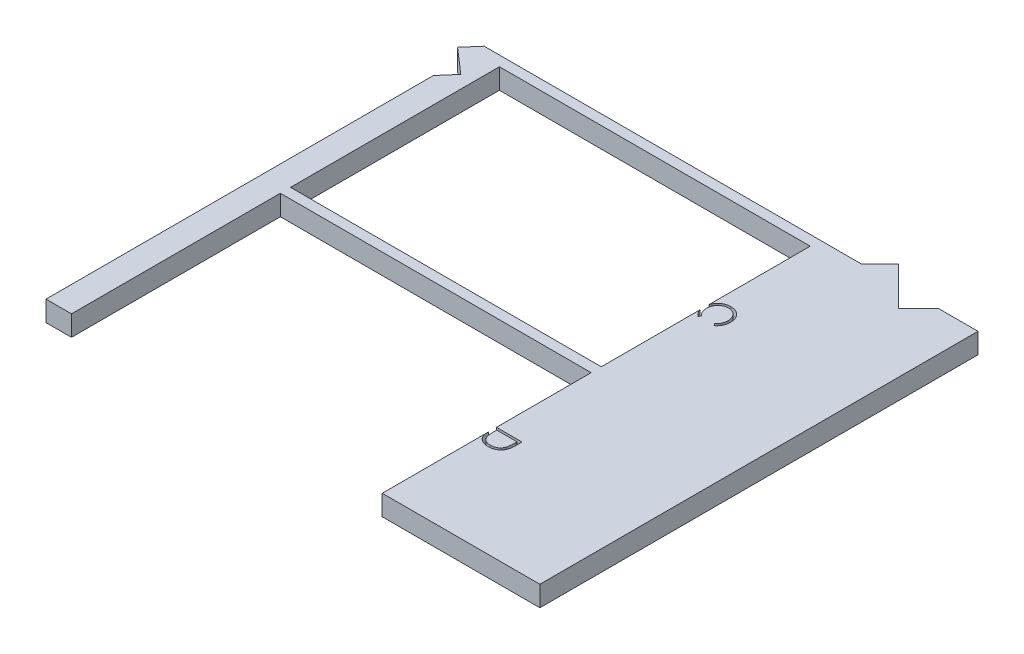
from build123d import *

# Parameters (mm, degrees)
SKETCH1_W           = 77.47
SKETCH1_H           = 52.07
BOSS_EXTRUDE4_DEPTH = 5.08
CUT_EXTRUDE9_DEPTH  = 5.08
CUT_EXTRUDE10_DEPTH = 5.08


with BuildPart() as part:
    # Sketch1 → Boss-Extrude4 (new body)
    with BuildSketch(Plane(origin=(0, 0, 0), x_dir=(1, 0, 0), z_dir=(0, 1, 0))):
        Polygon((-151.207591036, -110.49), (-146.05, -110.49), (-146.05, -58.42), (-68.58, -58.42), (-68.58, -110.49), (-55.88, -110.49), (-55.88, -58.42), (21.59, -58.42), (21.59, -110.49), (34.29, -110.49), (34.29, -58.42), (111.76, -58.42), (111.76, -110.49), (151.052408964, -110.49), (151.052408964, 110.49), (-151.207591036, 110.49), align=None)
        with Locations((-107.315, -29.845)):
            Rectangle(SKETCH1_W, SKETCH1_H, mode=Mode.SUBTRACT)
        with Locations((-17.145, -29.845)):
            Rectangle(SKETCH1_W, SKETCH1_H, mode=Mode.SUBTRACT)
        with Locations((73.025, -29.845)):
            Rectangle(SKETCH1_W, SKETCH1_H, mode=Mode.SUBTRACT)
        with Locations((-107.315, 24.765)):
            Rectangle(SKETCH1_W, SKETCH1_H, mode=Mode.SUBTRACT)
        with Locations((-17.145, 24.765)):
            Rectangle(SKETCH1_W, SKETCH1_H, mode=Mode.SUBTRACT)
        with Locations((-107.315, 79.375)):
            Rectangle(SKETCH1_W, SKETCH1_H, mode=Mode.SUBTRACT)
        with Locations((-17.145, 79.375)):
            Rectangle(SKETCH1_W, SKETCH1_H, mode=Mode.SUBTRACT)
        with Locations((73.025, 24.765)):
            Rectangle(SKETCH1_W, SKETCH1_H, mode=Mode.SUBTRACT)
        with Locations((73.025, 79.375)):
            Rectangle(SKETCH1_W, SKETCH1_H, mode=Mode.SUBTRACT)
    extrude(amount=BOSS_EXTRUDE4_DEPTH)

    # Sketch8 → Cut-Extrude9 (cut)
    # profile 1 of 7: a face of its own
    with BuildSketch(Plane(origin=(0, 5.08, 0), x_dir=(1, 0, 0), z_dir=(0, 1, 0))):
        Polygon((118.11, 79.293589744), (111.76, 76.362820513), (111.76, 76.982301683), (113.79525641, 77.921063702), (113.79525641, 80.799679487), (111.76, 81.765154247), (111.76, 82.387179487), (118.11, 79.375), align=None)
        Polygon((116.872309696, 79.340655048), (114.446538462, 80.49057492), (114.446538462, 78.221264022), align=None, mode=Mode.SUBTRACT)
    # profile 2 of 7: a face of its own
    with BuildSketch(Plane(origin=(0, 5.08, 0), x_dir=(1, 0, 0), z_dir=(0, 1, 0))):
        with BuildLine():
            Line((118.11, 26.474615385), (118.11, 25.235653045))
            add(Edge.make_bspline(
                [(118.11, 25.235653045), (118.109681139, 25.175004234), (118.109063106, 25.057451746), (118.099477996, 24.886510758), (118.086408481, 24.726402202), (118.065671027, 24.577079644), (118.040648803, 24.438612083), (118.010346937, 24.310582227), (117.974012938, 24.193397201), (117.916234684, 24.053492664), (117.830376936, 23.893979465), (117.703506539, 23.721262382), (117.548326213, 23.573571833), (117.37327911, 23.4462338), (117.180718496, 23.344994626), (116.975233967, 23.271753187), (116.75947595, 23.225383899), (116.611351899, 23.220615168), (116.536492388, 23.218205128)],
                knots=[0, 0, 0, 0, 1.001505555, 1.941167018, 2.826882275, 3.653841531, 4.429895133, 5.150066043, 5.825578002, 6.45369114, 7.647487171, 8.808567382, 9.977351308, 11.170798116, 12.373658725, 13.556498008, 14.765093433, 16, 16, 16, 16], degree=3))
            add(Edge.make_bspline(
                [(116.536492388, 23.218205128), (116.466353726, 23.220150205), (116.328524642, 23.223972465), (116.12725909, 23.261767034), (115.934882118, 23.318037757), (115.753765338, 23.399726219), (115.586236491, 23.504802861), (115.433291194, 23.631250472), (115.29863595, 23.781802882), (115.223670167, 23.894781468), (115.185590946, 23.952169471)],
                knots=[0, 0, 0, 0, 1.044266239, 2.052081639, 3.041743201, 4.026043445, 5.00270663, 5.980942822, 6.97441044, 8, 8, 8, 8], degree=3))
            add(Edge.make_bspline(
                [(115.185590946, 23.952169471), (115.157917248, 23.880020614), (115.10497061, 23.741981978), (115.010852235, 23.551885993), (114.90963819, 23.387448746), (114.798522364, 23.248489243), (114.677253559, 23.131437365), (114.548260115, 23.026322349), (114.405191505, 22.938259533), (114.252121508, 22.862606152), (114.090124446, 22.803067733), (113.919941192, 22.760940396), (113.743474705, 22.735055197), (113.623194862, 22.731525492), (113.562473958, 22.72974359)],
                knots=[0, 0, 0, 0, 1.272302504, 2.434229863, 3.488457646, 4.447234501, 5.35599188, 6.26022912, 7.18267843, 8.11661068, 9.06895546, 10.019249207, 11.000057067, 12, 12, 12, 12], degree=3))
            add(Edge.make_bspline(
                [(113.562473958, 22.72974359), (113.500485842, 22.731516424), (113.378522486, 22.735004524), (113.199347436, 22.7607231), (113.028142769, 22.804311677), (112.863691196, 22.864204763), (112.70692357, 22.942816916), (112.555876508, 23.036423505), (112.414573802, 23.150354586), (112.279655118, 23.277346904), (112.158418428, 23.421179366), (112.05048411, 23.576340817), (111.961311987, 23.745062992), (111.887341532, 23.924729456), (111.830014808, 24.116534097), (111.790215937, 24.31976575), (111.763336967, 24.53446858), (111.761131196, 24.681807332), (111.76, 24.757367788)],
                knots=[0, 0, 0, 0, 0.978404568, 1.925038397, 2.85041836, 3.763147166, 4.682162379, 5.614488577, 6.562659439, 7.54271123, 8.535210642, 9.526693784, 10.520907202, 11.541451354, 12.589717429, 13.675358278, 14.807842563, 16, 16, 16, 16], degree=3))
            Line((111.76, 24.757367788), (111.76, 26.474615385))
            Line((111.76, 26.474615385), (118.11, 26.474615385))
        make_face()
        with BuildLine():
            Line((117.458717949, 25.90474359), (115.423461538, 25.90474359))
            Line((115.423461538, 25.90474359), (115.423461538, 25.521860978))
            add(Edge.make_bspline(
                [(115.423461538, 25.521860978), (115.424181075, 25.465891945), (115.425571367, 25.357748368), (115.429679415, 25.200723225), (115.440678409, 25.055331233), (115.452311659, 24.921071395), (115.470224485, 24.798843581), (115.49214475, 24.688238604), (115.515124768, 24.588262886), (115.554315522, 24.473021329), (115.611648095, 24.342338932), (115.702715767, 24.203911992), (115.808237502, 24.079896012), (115.932241327, 23.976344233), (116.067626032, 23.890895914), (116.214403686, 23.833871415), (116.366844139, 23.793424687), (116.471770578, 23.789877771), (116.525044071, 23.788076923)],
                knots=[0, 0, 0, 0, 1.156481963, 2.23455883, 3.244418989, 4.168404366, 5.01828131, 5.794834307, 6.498111525, 7.13526334, 8.307595709, 9.435046769, 10.546766856, 11.659452936, 12.760769924, 13.837671619, 14.902137667, 16, 16, 16, 16], degree=3))
            add(Edge.make_bspline(
                [(116.525044071, 23.788076923), (116.56030457, 23.788977603), (116.629471889, 23.790744385), (116.729913527, 23.8068242), (116.82558773, 23.830156168), (116.914294057, 23.866607821), (116.998553798, 23.910685404), (117.074624411, 23.96802234), (117.1466735, 24.032775181), (117.212055599, 24.108821091), (117.270638216, 24.195791849), (117.322185781, 24.294516129), (117.362847974, 24.406172748), (117.399324126, 24.528230019), (117.4246346, 24.66264136), (117.445797527, 24.808093389), (117.456555228, 24.965820019), (117.457980962, 25.074940101), (117.458717949, 25.131346154)],
                knots=[0, 0, 0, 0, 0.911752476, 1.788502045, 2.626783689, 3.45400582, 4.26402138, 5.080402872, 5.911472738, 6.767166405, 7.66795952, 8.620018292, 9.640966946, 10.73819047, 11.913090943, 13.176185384, 14.540321519, 16, 16, 16, 16], degree=3))
            Line((117.458717949, 25.131346154), (117.458717949, 25.90474359))
        make_face(mode=Mode.SUBTRACT)
        with BuildLine():
            Line((114.772179487, 25.90474359), (112.411282051, 25.90474359))
            Line((112.411282051, 25.90474359), (112.411282051, 25.093185096))
            add(Edge.make_bspline(
                [(112.411282051, 25.093185096), (112.411975847, 25.035093328), (112.413313047, 24.923129104), (112.417726104, 24.761477849), (112.427553327, 24.612056238), (112.443574322, 24.47477829), (112.460221531, 24.348435585), (112.483262073, 24.23428334), (112.509456384, 24.132146551), (112.549993321, 24.013731405), (112.612860676, 23.880302727), (112.708268617, 23.736613475), (112.820435778, 23.607586425), (112.95189156, 23.499274679), (113.093745082, 23.409835086), (113.245254404, 23.347105881), (113.401797428, 23.306771901), (113.508807295, 23.302005692), (113.562473958, 23.299615385)],
                knots=[0, 0, 0, 0, 1.159821618, 2.235403267, 3.228114831, 4.14795534, 4.994323282, 5.771256229, 6.471395042, 7.097801288, 8.267864287, 9.404187171, 10.531774336, 11.667624178, 12.792825787, 13.866573821, 14.930062559, 16, 16, 16, 16], degree=3))
            add(Edge.make_bspline(
                [(113.562473958, 23.299615385), (113.596030503, 23.300103956), (113.662602321, 23.301073218), (113.760357737, 23.31624054), (113.855472736, 23.337399943), (113.946509043, 23.368040578), (114.034948011, 23.406675936), (114.119249173, 23.455161844), (114.2014282, 23.511153881), (114.305201688, 23.598743929), (114.42480707, 23.726024945), (114.541892162, 23.906931894), (114.636322991, 24.112618706), (114.676417579, 24.261803289), (114.697129407, 24.338868189)],
                knots=[0, 0, 0, 0, 0.723503378, 1.435336582, 2.130201219, 2.824764462, 3.504949994, 4.209866579, 4.920640069, 5.648298893, 7.13757748, 8.670694625, 10.280166878, 12, 12, 12, 12], degree=3))
            add(Edge.make_bspline(
                [(114.697129407, 24.338868189), (114.703398338, 24.369763806), (114.716990673, 24.436751875), (114.731329404, 24.545986183), (114.744191712, 24.671110852), (114.753456167, 24.811591078), (114.763401398, 24.967985569), (114.767131466, 25.140244081), (114.771684212, 25.328488394), (114.772010172, 25.459103286), (114.772179487, 25.526949119)],
                knots=[0, 0, 0, 0, 0.634452549, 1.375623993, 2.216454381, 3.166361212, 4.209414599, 5.370755378, 6.634280627, 8, 8, 8, 8], degree=3))
            Line((114.772179487, 25.526949119), (114.772179487, 25.90474359))
        make_face(mode=Mode.SUBTRACT)
    # profile 3 of 7: a face of its own
    with BuildSketch(Plane(origin=(0, 5.08, 0), x_dir=(1, 0, 0), z_dir=(0, 1, 0))):
        with BuildLine():
            Line((116.944815705, -32.938589744), (116.563205128, -32.439951923))
            add(Edge.make_bspline(
                [(116.563205128, -32.439951923), (116.605597673, -32.40438124), (116.689811221, -32.333719444), (116.808065537, -32.220037748), (116.918855368, -32.10156191), (117.022708493, -31.978337218), (117.115993196, -31.848145673), (117.203570769, -31.714141081), (117.282070808, -31.574081771), (117.377253654, -31.380403623), (117.476578821, -31.127042527), (117.559860398, -30.808100462), (117.612875959, -30.475158898), (117.618617886, -30.248014681), (117.621538462, -30.132479968)],
                knots=[0, 0, 0, 0, 0.757959112, 1.505699292, 2.245454638, 2.979532153, 3.711538275, 4.438200793, 5.171680507, 5.909471876, 7.393775596, 8.890124382, 10.418191784, 12, 12, 12, 12], degree=3))
            add(Edge.make_bspline(
                [(117.621538462, -30.132479968), (117.620802251, -30.068829613), (117.619336663, -29.942119638), (117.600137483, -29.754060275), (117.572842033, -29.56915638), (117.533326202, -29.388095544), (117.481880175, -29.211237272), (117.421547717, -29.037234935), (117.346470096, -28.868137816), (117.263556886, -28.701910874), (117.169880198, -28.542661658), (117.067735433, -28.391952614), (116.958125128, -28.250472259), (116.84133222, -28.117828549), (116.715905207, -27.995476207), (116.58331959, -27.881454356), (116.441979536, -27.777817938), (116.294535759, -27.682020268), (116.140771545, -27.596777475), (115.9816542, -27.523166197), (115.817792087, -27.46007521), (115.648849522, -27.409690045), (115.475491338, -27.369948117), (115.297349628, -27.342492588), (115.114770175, -27.323466123), (114.991019157, -27.322014016), (114.928639824, -27.321282051)],
                knots=[0, 0, 0, 0, 1.055000685, 2.100209969, 3.131349012, 4.153242145, 5.170189196, 6.184191144, 7.204341339, 8.235672124, 9.263040994, 10.265373269, 11.252624173, 12.22887325, 13.193405896, 14.155809299, 15.126090485, 16.097288279, 17.069732292, 18.038585918, 19.002221264, 19.978698174, 20.959418239, 21.948869816, 22.966084182, 24, 24, 24, 24], degree=3))
            add(Edge.make_bspline(
                [(114.928639824, -27.321282051), (114.834784429, -27.323571352), (114.650511811, -27.328066089), (114.380599417, -27.368068066), (114.122026195, -27.428855875), (113.876408481, -27.519961279), (113.640717603, -27.632300128), (113.418941397, -27.774250951), (113.207728487, -27.938655241), (113.012070568, -28.12783883), (112.833338524, -28.335403668), (112.675948183, -28.55810345), (112.544748325, -28.795383515), (112.435571964, -29.044623973), (112.351649044, -29.307742779), (112.29256842, -29.584266778), (112.254029036, -29.873594541), (112.250339344, -30.071296166), (112.248461538, -30.171913061)],
                knots=[0, 0, 0, 0, 1.029171465, 2.020641659, 2.987623507, 3.938342917, 4.889210282, 5.84687017, 6.821220943, 7.821438502, 8.827599549, 9.822697543, 10.807740252, 11.797342354, 12.80366471, 13.83203677, 14.896651826, 16, 16, 16, 16], degree=3))
            add(Edge.make_bspline(
                [(112.248461538, -30.171913061), (112.251525467, -30.282770797), (112.257556013, -30.50096534), (112.308644936, -30.820947331), (112.391481444, -31.127263648), (112.507410532, -31.41993077), (112.658114697, -31.698123628), (112.840809417, -31.962277569), (113.057232535, -32.212615561), (113.222483354, -32.363149173), (113.306794872, -32.439951923)],
                knots=[0, 0, 0, 0, 1.028121516, 2.023589091, 2.998037872, 3.967518031, 4.937445131, 5.927275754, 6.942489185, 8, 8, 8, 8], degree=3))
            Line((113.306794872, -32.439951923), (112.929000401, -32.938589744))
            add(Edge.make_bspline(
                [(112.929000401, -32.938589744), (112.877223407, -32.898461226), (112.773917427, -32.818396404), (112.628282924, -32.688750355), (112.491292127, -32.552178781), (112.36407883, -32.407649584), (112.243987323, -32.256891333), (112.135043577, -32.097248498), (112.033928993, -31.93147842), (111.942568033, -31.758615962), (111.860652906, -31.579228654), (111.791497891, -31.393503181), (111.731069307, -31.20301302), (111.681684053, -31.007662239), (111.643076564, -30.806798224), (111.617282312, -30.601110145), (111.599606535, -30.390163816), (111.597995761, -30.247848605), (111.597179487, -30.175729167)],
                knots=[0, 0, 0, 0, 0.986756325, 1.968786143, 2.935506311, 3.899499537, 4.868307269, 5.8376204, 6.809456583, 7.792545619, 8.781780509, 9.778496008, 10.776623214, 11.79151764, 12.812666265, 13.856269958, 14.913646641, 16, 16, 16, 16], degree=3))
            add(Edge.make_bspline(
                [(111.597179487, -30.175729167), (111.597654817, -30.107432799), (111.598594721, -29.97238519), (111.613820511, -29.772997455), (111.634593605, -29.578887787), (111.665872129, -29.390610966), (111.702782574, -29.207139554), (111.752260425, -29.030136779), (111.807685342, -28.857860898), (111.872827246, -28.691004051), (111.946335178, -28.52942431), (112.029414149, -28.373642823), (112.121365532, -28.223731239), (112.220162479, -28.07821569), (112.328978441, -27.939245788), (112.446302192, -27.805617249), (112.571738298, -27.676580756), (112.662189246, -27.596747314), (112.707666266, -27.556608574)],
                knots=[0, 0, 0, 0, 1.114604814, 2.203992996, 3.262667896, 4.300477797, 5.318619304, 6.316056647, 7.298880507, 8.271930387, 9.238335007, 10.195173496, 11.151986948, 12.108099108, 13.064862484, 14.031167946, 15.010108607, 16, 16, 16, 16], degree=3))
            add(Edge.make_bspline(
                [(112.707666266, -27.556608574), (112.786662423, -27.492318192), (112.943701026, -27.364513598), (113.198219878, -27.200999858), (113.463955057, -27.061032151), (113.742302642, -26.947864409), (114.032638045, -26.859394879), (114.335107621, -26.798106139), (114.649428887, -26.758279657), (114.86321849, -26.753725276), (114.971889022, -26.751410256)],
                knots=[0, 0, 0, 0, 0.994628077, 1.977248131, 2.950237994, 3.925870899, 4.908910175, 5.911660606, 6.938484602, 8, 8, 8, 8], degree=3))
            add(Edge.make_bspline(
                [(114.971889022, -26.751410256), (115.086103424, -26.754244442), (115.310813128, -26.759820525), (115.640671219, -26.806804203), (115.956243845, -26.883302707), (116.258745252, -26.988641657), (116.546444643, -27.127611896), (116.820557094, -27.295846609), (117.080858784, -27.494989044), (117.324021732, -27.72253816), (117.546337205, -27.97213776), (117.741930009, -28.239412742), (117.904702809, -28.523860895), (118.040767384, -28.82234304), (118.145350881, -29.137095699), (118.218563099, -29.467446937), (118.264132722, -29.812776116), (118.269893457, -30.048383659), (118.272820513, -30.168096955)],
                knots=[0, 0, 0, 0, 1.032901378, 2.032168977, 3.007206631, 3.966850309, 4.924221947, 5.891988639, 6.871730993, 7.884084801, 8.900290346, 9.89161143, 10.874607481, 11.860025555, 12.854717796, 13.869097222, 14.917278314, 16, 16, 16, 16], degree=3))
            add(Edge.make_bspline(
                [(118.272820513, -30.168096955), (118.27194643, -30.24105764), (118.270216271, -30.385475968), (118.253322795, -30.599110851), (118.225211517, -30.807112405), (118.186697164, -31.009983654), (118.139491479, -31.208460249), (118.077695589, -31.40050597), (118.005935411, -31.587166578), (117.925394904, -31.768581871), (117.833318651, -31.942778105), (117.733314188, -32.109723579), (117.623073079, -32.267404402), (117.506239897, -32.418786561), (117.378444314, -32.560461963), (117.243848093, -32.696476823), (117.098457292, -32.822132675), (116.996123317, -32.89969966), (116.944815705, -32.938589744)],
                knots=[0, 0, 0, 0, 1.096705196, 2.170817488, 3.219277236, 4.250701065, 5.274195539, 6.284202015, 7.28098643, 8.279664616, 9.266225751, 10.241373748, 11.203306326, 12.157093976, 13.114198862, 14.069774147, 15.032234603, 16, 16, 16, 16], degree=3))
        make_face()
    # profile 4 of 7: a face of its own
    with BuildSketch(Plane(origin=(0, 5.08, 0), x_dir=(1, 0, 0), z_dir=(0, 1, 0))):
        with BuildLine():
            Line((111.76, -82.012692308), (118.11, -82.012692308))
            Line((118.11, -82.012692308), (118.11, -83.294903846))
            add(Edge.make_bspline(
                [(118.11, -83.294903846), (118.10919924, -83.406426385), (118.107652175, -83.62188735), (118.097786915, -83.933238257), (118.080511466, -84.220906485), (118.054862343, -84.484728674), (118.024076207, -84.725128674), (117.984923928, -84.941721457), (117.938878197, -85.134858028), (117.899605318, -85.253638066), (117.881033654, -85.309807692)],
                knots=[0, 0, 0, 0, 1.314317071, 2.539253741, 3.67075822, 4.709970291, 5.662644612, 6.526156501, 7.303037452, 8, 8, 8, 8], degree=3))
            add(Edge.make_bspline(
                [(117.881033654, -85.309807692), (117.853037914, -85.383276673), (117.797681284, -85.528548601), (117.693258165, -85.735390771), (117.574941266, -85.930107124), (117.44258475, -86.11375686), (117.2924032, -86.282089414), (117.130916153, -86.441891296), (116.951524797, -86.585988874), (116.760320009, -86.720164865), (116.555362101, -86.837571052), (116.340810785, -86.941109671), (116.117067511, -87.029513574), (115.882503759, -87.098492965), (115.639371325, -87.15548169), (115.385829701, -87.193719768), (115.123356971, -87.219119775), (114.945238152, -87.221659883), (114.854861779, -87.222948718)],
                knots=[0, 0, 0, 0, 0.98467389, 1.947018643, 2.898343565, 3.837828625, 4.779009928, 5.722093987, 6.681368302, 7.658573986, 8.646467994, 9.637429229, 10.641859304, 11.657149908, 12.698561448, 13.768651538, 14.867827761, 16, 16, 16, 16], degree=3))
            add(Edge.make_bspline(
                [(114.854861779, -87.222948718), (114.776373797, -87.221806822), (114.621705032, -87.219556598), (114.39375275, -87.199375846), (114.172580583, -87.169987158), (113.959159893, -87.124695693), (113.752052982, -87.069043404), (113.552243376, -87.000351318), (113.359584615, -86.918944546), (113.175646042, -86.82449634), (113.000731948, -86.721221421), (112.837852299, -86.607986514), (112.683909336, -86.491289421), (112.545846691, -86.362132049), (112.415768103, -86.229414775), (112.300701958, -86.08609986), (112.195636064, -85.936856417), (112.101337325, -85.778809783), (112.019522725, -85.608171823), (111.94943361, -85.422613554), (111.891722261, -85.221141181), (111.843495333, -85.004063511), (111.805260876, -84.770955192), (111.779629867, -84.521602395), (111.762298604, -84.256383924), (111.760781079, -84.074267288), (111.76, -83.980530849)],
                knots=[0, 0, 0, 0, 1.105818345, 2.179130549, 3.222742436, 4.24813173, 5.251184997, 6.243232575, 7.223185975, 8.195898781, 9.155064964, 10.083206407, 10.990357329, 11.874224667, 12.744762365, 13.607037788, 14.46074101, 15.315384698, 16.197310979, 17.123950979, 18.107232398, 19.148086642, 20.256146639, 21.433991621, 22.679261309, 24, 24, 24, 24], degree=3))
            Line((111.76, -83.980530849), (111.76, -82.012692308))
        make_face()
        with BuildLine():
            Line((112.411282051, -82.582564103), (112.411282051, -83.311440304))
            add(Edge.make_bspline(
                [(112.411282051, -83.311440304), (112.411732169, -83.416176063), (112.41259791, -83.617621283), (112.420194693, -83.907286506), (112.432607922, -84.171953411), (112.449979849, -84.411659579), (112.472964337, -84.626269665), (112.498590946, -84.816232183), (112.53051775, -84.980924438), (112.559457347, -85.08058213), (112.572830529, -85.126634615)],
                knots=[0, 0, 0, 0, 1.375205317, 2.645023457, 3.804390687, 4.853969522, 5.800190428, 6.637939096, 7.370582563, 8, 8, 8, 8], degree=3))
            add(Edge.make_bspline(
                [(112.572830529, -85.126634615), (112.593242549, -85.184599298), (112.633579048, -85.299144178), (112.707184232, -85.464010709), (112.794265109, -85.61784952), (112.891632722, -85.763227177), (113.000795015, -85.899202305), (113.122082386, -86.02517169), (113.254153497, -86.142030641), (113.397503093, -86.248500834), (113.551204387, -86.34363756), (113.713300631, -86.426559757), (113.883400607, -86.496918019), (114.062117399, -86.554129451), (114.249282549, -86.598465023), (114.444403664, -86.63000926), (114.647541614, -86.649619319), (114.785702691, -86.651909464), (114.856133814, -86.653076923)],
                knots=[0, 0, 0, 0, 0.998463025, 1.973077781, 2.929496817, 3.867873318, 4.813809365, 5.759268434, 6.706333209, 7.676553387, 8.657505312, 9.640584699, 10.632319813, 11.645628493, 12.686877747, 13.755137172, 14.855624085, 16, 16, 16, 16], degree=3))
            add(Edge.make_bspline(
                [(114.856133814, -86.653076923), (114.930398398, -86.652144681), (115.07629183, -86.650313282), (115.290366967, -86.627332533), (115.49623045, -86.593678155), (115.694030492, -86.545268959), (115.88350975, -86.482728451), (116.065738702, -86.407893664), (116.238372234, -86.317032486), (116.402872487, -86.214168026), (116.556748208, -86.098683831), (116.698196661, -85.971092184), (116.827481331, -85.832738462), (116.94480806, -85.684260293), (117.048090353, -85.523581703), (117.139968669, -85.353421689), (117.218033951, -85.17138332), (117.259539698, -85.044720759), (117.280633013, -84.980350561)],
                knots=[0, 0, 0, 0, 1.122272916, 2.204715076, 3.251197285, 4.274229216, 5.279697671, 6.265416158, 7.248880903, 8.225321784, 9.195852973, 10.153576302, 11.101466393, 12.055578741, 13.010401466, 13.985536859, 14.976245305, 16, 16, 16, 16], degree=3))
            add(Edge.make_bspline(
                [(117.280633013, -84.980350561), (117.295358532, -84.927099195), (117.326669026, -84.813872182), (117.36082363, -84.629106297), (117.390948936, -84.421161669), (117.416454236, -84.189115068), (117.434755519, -83.933231006), (117.448492047, -83.653312687), (117.457756937, -83.349239119), (117.458389591, -83.138450807), (117.458717949, -83.029048478)],
                knots=[0, 0, 0, 0, 0.674548936, 1.434276114, 2.292660221, 3.240891867, 4.284742987, 5.42552168, 6.663806718, 8, 8, 8, 8], degree=3))
            Line((117.458717949, -83.029048478), (117.458717949, -82.582564103))
            Line((117.458717949, -82.582564103), (112.411282051, -82.582564103))
        make_face(mode=Mode.SUBTRACT)
    # profile 5 of 7: a face of its own
    with BuildSketch(Plane(origin=(0, 5.08, 0), x_dir=(1, 0, 0), z_dir=(0, 1, 0))):
        with BuildLine():
            Line((-108.006987179, 107.852307692), (-108.291923077, 107.852307692))
            add(Edge.make_bspline(
                [(-108.291923077, 107.852307692), (-108.284203699, 107.884268588), (-108.269112946, 107.946749526), (-108.23763729, 108.03601897), (-108.203347966, 108.120495307), (-108.162173564, 108.198596746), (-108.117262051, 108.271892893), (-108.065806439, 108.338721313), (-108.010180691, 108.400781646), (-107.948653773, 108.455857226), (-107.884129915, 108.50572988), (-107.815699939, 108.548252254), (-107.7447406, 108.584832021), (-107.670760258, 108.614967517), (-107.593538659, 108.637669242), (-107.513773929, 108.654140059), (-107.43125704, 108.664836284), (-107.375243154, 108.66588019), (-107.346800881, 108.666410256)],
                knots=[0, 0, 0, 0, 1.162005537, 2.271625781, 3.343758855, 4.383309926, 5.390229558, 6.379919256, 7.361854164, 8.333198761, 9.295911338, 10.242430842, 11.177959212, 12.116337295, 13.062827104, 14.020064771, 14.994644689, 16, 16, 16, 16], degree=3))
            add(Edge.make_bspline(
                [(-107.346800881, 108.666410256), (-107.305360108, 108.665159098), (-107.223382505, 108.662684071), (-107.102947456, 108.640083118), (-106.986808841, 108.604318891), (-106.876237881, 108.554903438), (-106.773532588, 108.493954947), (-106.682150476, 108.421415507), (-106.603330184, 108.338684712), (-106.53720457, 108.247305886), (-106.485429392, 108.14964696), (-106.447251039, 108.049135389), (-106.424008514, 107.9460096), (-106.420996295, 107.876379783), (-106.419487179, 107.841495393)],
                knots=[0, 0, 0, 0, 1.083050992, 2.142477498, 3.193116406, 4.255571735, 5.30263384, 6.308962982, 7.297363603, 8.282367274, 9.249857812, 10.179914175, 11.08814088, 12, 12, 12, 12], degree=3))
            add(Edge.make_bspline(
                [(-106.419487179, 107.841495393), (-106.420542723, 107.807924943), (-106.422608257, 107.742232783), (-106.44014669, 107.646328282), (-106.469661729, 107.555939116), (-106.510546442, 107.470684776), (-106.563470562, 107.391105814), (-106.627580795, 107.317023185), (-106.703329638, 107.248108306), (-106.760732674, 107.208629927), (-106.790285457, 107.188305288)],
                knots=[0, 0, 0, 0, 1.024540389, 2.004866551, 2.965041327, 3.920577974, 4.882998113, 5.874504559, 6.905732034, 8, 8, 8, 8], degree=3))
            add(Edge.make_bspline(
                [(-106.790285457, 107.188305288), (-106.756510937, 107.171996519), (-106.689593843, 107.139684128), (-106.598380149, 107.076314977), (-106.515578076, 107.003148148), (-106.469401131, 106.94605017), (-106.44619992, 106.917361779)],
                knots=[0, 0, 0, 0, 1.015518401, 2.012035669, 3.001164323, 4, 4, 4, 4], degree=3))
            add(Edge.make_bspline(
                [(-106.44619992, 106.917361779), (-106.430922416, 106.896445104), (-106.400617589, 106.85495428), (-106.363211069, 106.788246236), (-106.329275659, 106.720798814), (-106.302832245, 106.65080421), (-106.282354523, 106.57907369), (-106.267716837, 106.505484088), (-106.258623509, 106.429975311), (-106.257321258, 106.378891847), (-106.256666667, 106.353214143)],
                knots=[0, 0, 0, 0, 1.025084078, 2.033381695, 3.024893161, 4.013698104, 4.991890475, 5.976764909, 6.982997093, 8, 8, 8, 8], degree=3))
            add(Edge.make_bspline(
                [(-106.256666667, 106.353214143), (-106.258294547, 106.308755324), (-106.261542646, 106.220046911), (-106.290574914, 106.088987699), (-106.335581211, 105.960875994), (-106.399495717, 105.838343818), (-106.477389814, 105.723698758), (-106.570061101, 105.621122392), (-106.676456629, 105.532949372), (-106.795116039, 105.459280094), (-106.923673719, 105.400390265), (-107.061174435, 105.359516727), (-107.205636984, 105.332895713), (-107.304703604, 105.330041054), (-107.355069111, 105.328589744)],
                knots=[0, 0, 0, 0, 0.955779014, 1.907060117, 2.875433937, 3.871313158, 4.872415639, 5.851225146, 6.836215519, 7.83643374, 8.849228613, 9.86973379, 10.916971861, 12, 12, 12, 12], degree=3))
            add(Edge.make_bspline(
                [(-107.355069111, 105.328589744), (-107.389013762, 105.329377337), (-107.455805515, 105.330927058), (-107.553997832, 105.341521218), (-107.647725373, 105.36087058), (-107.737114866, 105.386908578), (-107.82224572, 105.419921087), (-107.902858158, 105.46103162), (-107.979448133, 105.509392769), (-108.051292896, 105.565575381), (-108.118383883, 105.628423453), (-108.17893814, 105.699052698), (-108.233965237, 105.776157486), (-108.281991774, 105.860633401), (-108.325205295, 105.951388741), (-108.36074802, 106.049585593), (-108.392031357, 106.154346099), (-108.406576, 106.227350906), (-108.414038462, 106.264807692)],
                knots=[0, 0, 0, 0, 1.048658725, 2.063410685, 3.046034179, 4.001477787, 4.936774919, 5.862367409, 6.792675028, 7.730719943, 8.675894397, 9.627829632, 10.600096036, 11.597688215, 12.626045268, 13.701542398, 14.82072376, 16, 16, 16, 16], degree=3))
            Line((-108.414038462, 106.264807692), (-108.129102564, 106.264807692))
            add(Edge.make_bspline(
                [(-108.129102564, 106.264807692), (-108.12167915, 106.240361087), (-108.107239964, 106.192810317), (-108.082661565, 106.124375183), (-108.054659633, 106.061638949), (-108.024619997, 106.004141403), (-107.993070978, 105.951316295), (-107.957769582, 105.904560456), (-107.921330429, 105.861820237), (-107.89386273, 105.837740482), (-107.880419671, 105.825955529)],
                knots=[0, 0, 0, 0, 1.198163088, 2.33053128, 3.407730985, 4.417276592, 5.372219308, 6.28897303, 7.162600585, 8, 8, 8, 8], degree=3))
            add(Edge.make_bspline(
                [(-107.880419671, 105.825955529), (-107.862642777, 105.812250112), (-107.827143861, 105.784881583), (-107.769296966, 105.749955106), (-107.708459534, 105.71969189), (-107.643313365, 105.696574537), (-107.575264252, 105.677000516), (-107.503212285, 105.664191188), (-107.427793138, 105.655402633), (-107.376296667, 105.654627088), (-107.34998097, 105.654230769)],
                knots=[0, 0, 0, 0, 0.946170439, 1.889420265, 2.845303464, 3.807233317, 4.801018734, 5.828864929, 6.890507805, 8, 8, 8, 8], degree=3))
            add(Edge.make_bspline(
                [(-107.34998097, 105.654230769), (-107.320268864, 105.654789483), (-107.262169405, 105.655882), (-107.177392497, 105.665929249), (-107.096740741, 105.680561838), (-107.021109587, 105.703161472), (-106.949508341, 105.731084102), (-106.882940702, 105.766143727), (-106.820532806, 105.807277867), (-106.763083988, 105.854031247), (-106.711426277, 105.905213603), (-106.665942576, 105.958746889), (-106.627275919, 106.014405392), (-106.596085101, 106.072497116), (-106.571455674, 106.132781502), (-106.55468877, 106.195427726), (-106.54303061, 106.259923103), (-106.542081183, 106.303764382), (-106.541602564, 106.325865385)],
                knots=[0, 0, 0, 0, 1.217147791, 2.380027433, 3.494444702, 4.572153297, 5.609568379, 6.639424714, 7.649109417, 8.668170816, 9.669597737, 10.625200337, 11.543417969, 12.441394052, 13.322311151, 14.205496177, 15.095365482, 16, 16, 16, 16], degree=3))
            add(Edge.make_bspline(
                [(-106.541602564, 106.325865385), (-106.542990766, 106.355448528), (-106.545760263, 106.414467612), (-106.566904474, 106.501297126), (-106.601683301, 106.584956936), (-106.650371936, 106.664019688), (-106.709640776, 106.737294971), (-106.778914656, 106.802674101), (-106.858768834, 106.856621969), (-106.93226543, 106.893895251), (-106.997366679, 106.919328883), (-107.053079206, 106.936269744), (-107.115451268, 106.950614988), (-107.183728599, 106.96396112), (-107.258425659, 106.975319772), (-107.339461128, 106.984791991), (-107.426851426, 106.992371206), (-107.487349841, 106.995755843), (-107.518525641, 106.9975)],
                knots=[0, 0, 0, 0, 1.07054697, 2.135767047, 3.216561865, 4.33974944, 5.486079747, 6.621378074, 7.775625952, 8.963672916, 9.598146892, 10.304877434, 11.070270905, 11.915000392, 12.823868403, 13.805723172, 14.86925407, 16, 16, 16, 16], degree=3))
            Line((-107.518525641, 106.9975), (-107.518525641, 107.323141026))
            add(Edge.make_bspline(
                [(-107.518525641, 107.323141026), (-107.479245298, 107.323807598), (-107.402304755, 107.325113248), (-107.289914921, 107.340904801), (-107.182442702, 107.36274937), (-107.082269872, 107.396209509), (-106.990967111, 107.435071778), (-106.911755757, 107.480294854), (-106.84574556, 107.530563948), (-106.793257302, 107.586654958), (-106.753770073, 107.64681218), (-106.724898621, 107.709510862), (-106.707844039, 107.775300546), (-106.705567413, 107.82019928), (-106.704423077, 107.842767428)],
                knots=[0, 0, 0, 0, 1.321986639, 2.589447074, 3.816329219, 5.01088745, 6.139805852, 7.153945165, 8.075214402, 8.924034688, 9.728124013, 10.488707548, 11.240355623, 12, 12, 12, 12], degree=3))
            add(Edge.make_bspline(
                [(-106.704423077, 107.842767428), (-106.704799007, 107.859347954), (-106.705546902, 107.892334124), (-106.714978718, 107.94052615), (-106.729151955, 107.987244866), (-106.748637138, 108.032291594), (-106.774717676, 108.075353913), (-106.80592882, 108.116798956), (-106.84309274, 108.156390099), (-106.885678967, 108.19329296), (-106.931409676, 108.228462197), (-106.981529114, 108.258319567), (-107.034526101, 108.283851159), (-107.090459309, 108.304905493), (-107.149510255, 108.320743562), (-107.211401489, 108.332115361), (-107.27625103, 108.339225234), (-107.320493959, 108.340248868), (-107.342984776, 108.340769231)],
                knots=[0, 0, 0, 0, 0.884392785, 1.759457502, 2.611959086, 3.489218968, 4.37281399, 5.2945488, 6.255912374, 7.266815255, 8.301784654, 9.332968512, 10.37626691, 11.440494194, 12.520033166, 13.637162961, 14.798855837, 16, 16, 16, 16], degree=3))
            add(Edge.make_bspline(
                [(-107.342984776, 108.340769231), (-107.379135932, 108.339507067), (-107.449747547, 108.337041767), (-107.551542508, 108.315449033), (-107.646175046, 108.280997486), (-107.718509408, 108.239873961), (-107.771924315, 108.199278925), (-107.810094109, 108.163825617), (-107.847577715, 108.124425841), (-107.88190915, 108.078652887), (-107.916629115, 108.029606584), (-107.94823811, 107.974793673), (-107.978953688, 107.915643972), (-107.997461715, 107.873828647), (-108.006987179, 107.852307692)],
                knots=[0, 0, 0, 0, 1.472543308, 2.876219568, 4.221790263, 5.565193594, 6.249813518, 6.953379497, 7.687249741, 8.463570142, 9.283606569, 10.136032583, 11.040678096, 12, 12, 12, 12], degree=3))
        make_face()
    # profile 6 of 7: a face of its own
    with BuildSketch(Plane(origin=(0, 5.08, 0), x_dir=(1, 0, 0), z_dir=(0, 1, 0))):
        with BuildLine():
            Line((-17.836987179, 107.608076923), (-18.121923077, 107.608076923))
            add(Edge.make_bspline(
                [(-18.121923077, 107.608076923), (-18.120066017, 107.645878371), (-18.1164188, 107.720119409), (-18.099338852, 107.828363239), (-18.074899627, 107.931827235), (-18.040345237, 108.029680657), (-17.997431685, 108.122788718), (-17.945969446, 108.210781589), (-17.885015024, 108.293323596), (-17.81588463, 108.369649547), (-17.74080165, 108.4396697), (-17.659788405, 108.500135528), (-17.574657559, 108.551223701), (-17.48566739, 108.593933113), (-17.391813879, 108.625991402), (-17.293948715, 108.649778175), (-17.191641927, 108.664089574), (-17.12193705, 108.665627894), (-17.086486378, 108.666410256)],
                knots=[0, 0, 0, 0, 1.10065271, 2.161652631, 3.183658789, 4.190468796, 5.17591951, 6.163126047, 7.15150782, 8.156236427, 9.156009102, 10.134482811, 11.092018607, 12.041330605, 13.001268258, 13.972401359, 14.968799086, 16, 16, 16, 16], degree=3))
            add(Edge.make_bspline(
                [(-17.086486378, 108.666410256), (-17.051671982, 108.665595228), (-16.983262938, 108.663993726), (-16.883420968, 108.650240507), (-16.788372994, 108.628699863), (-16.698304806, 108.598478021), (-16.613935018, 108.557852148), (-16.534629828, 108.509050095), (-16.459445093, 108.452607819), (-16.391766082, 108.386156146), (-16.329619467, 108.315215411), (-16.276005278, 108.239479956), (-16.230091909, 108.161257675), (-16.191821656, 108.079952092), (-16.163649302, 107.994797659), (-16.142260499, 107.907034125), (-16.13017063, 107.815753047), (-16.128315139, 107.753970671), (-16.127371795, 107.722560096)],
                knots=[0, 0, 0, 0, 1.111607364, 2.184268762, 3.212621178, 4.221274766, 5.211760367, 6.196651075, 7.1921475, 8.207485113, 9.220403448, 10.201281604, 11.166441695, 12.114753415, 13.065576456, 14.026450734, 14.996634279, 16, 16, 16, 16], degree=3))
            add(Edge.make_bspline(
                [(-16.127371795, 107.722560096), (-16.128907826, 107.678338846), (-16.131952934, 107.590672367), (-16.158000975, 107.461844598), (-16.198683167, 107.337027711), (-16.247666484, 107.236573158), (-16.297080773, 107.155625632), (-16.341610154, 107.088979021), (-16.393738947, 107.01721906), (-16.45422587, 106.940586047), (-16.52181969, 106.858479726), (-16.597132653, 106.770949697), (-16.680701811, 106.678900306), (-16.739356308, 106.616030225), (-16.769749599, 106.583452524)],
                knots=[0, 0, 0, 0, 1.184426356, 2.348067706, 3.509069118, 4.696110526, 5.333549288, 6.050745305, 6.844228056, 7.710549037, 8.667450064, 9.695053472, 10.805634456, 12, 12, 12, 12], degree=3))
            Line((-16.769749599, 106.583452524), (-17.564135617, 105.735641026))
            Line((-17.564135617, 105.735641026), (-16.086666667, 105.735641026))
            Line((-16.086666667, 105.735641026), (-16.086666667, 105.41))
            Line((-16.086666667, 105.41), (-18.244038462, 105.41))
            Line((-18.244038462, 105.41), (-17.012708333, 106.72401242))
            add(Edge.make_bspline(
                [(-17.012708333, 106.72401242), (-16.982729179, 106.755307312), (-16.925145359, 106.815418396), (-16.843699735, 106.903178081), (-16.770548653, 106.984593736), (-16.70521859, 107.059511533), (-16.649126767, 107.129027313), (-16.599349814, 107.190889651), (-16.559466742, 107.247816902), (-16.516182061, 107.313803031), (-16.474259378, 107.39436849), (-16.438234598, 107.492824051), (-16.416268271, 107.59417663), (-16.413633171, 107.662667764), (-16.412307692, 107.697119391)],
                knots=[0, 0, 0, 0, 1.329631726, 2.553950428, 3.673215718, 4.687767853, 5.603093632, 6.413772471, 7.123043292, 7.734684054, 8.834405432, 9.900288307, 10.943827018, 12, 12, 12, 12], degree=3))
            add(Edge.make_bspline(
                [(-16.412307692, 107.697119391), (-16.412884401, 107.718783231), (-16.414020984, 107.7614785), (-16.424051896, 107.824076581), (-16.439210712, 107.884460376), (-16.460932482, 107.942815624), (-16.48960431, 107.998555608), (-16.524505162, 108.051748179), (-16.564773291, 108.103173169), (-16.611356228, 108.151390804), (-16.662529535, 108.195551612), (-16.716590033, 108.234671318), (-16.773785485, 108.26736394), (-16.833874739, 108.294164112), (-16.896690271, 108.315187494), (-16.962353576, 108.329754919), (-17.030683219, 108.338901173), (-17.077340748, 108.340138671), (-17.101114784, 108.340769231)],
                knots=[0, 0, 0, 0, 0.991446411, 1.95395049, 2.89581595, 3.838931463, 4.798493298, 5.75982156, 6.748411868, 7.785213223, 8.824556874, 9.840280684, 10.836137867, 11.835679398, 12.848801643, 13.863922112, 14.911575587, 16, 16, 16, 16], degree=3))
            add(Edge.make_bspline(
                [(-17.101114784, 108.340769231), (-17.125944039, 108.340120594), (-17.174704597, 108.33884678), (-17.246295434, 108.32993622), (-17.314590389, 108.314563922), (-17.379761259, 108.293539367), (-17.441918311, 108.266816255), (-17.500759266, 108.233531601), (-17.556152029, 108.193813718), (-17.608200733, 108.148782642), (-17.656155914, 108.098647032), (-17.698289865, 108.042757994), (-17.735105364, 107.982135982), (-17.767226597, 107.916944568), (-17.793312116, 107.846592211), (-17.813244903, 107.77132865), (-17.829017256, 107.691480682), (-17.834286414, 107.636339927), (-17.836987179, 107.608076923)],
                knots=[0, 0, 0, 0, 1.031018746, 2.02475058, 2.990194455, 3.934040569, 4.864654155, 5.795059489, 6.735614925, 7.690564532, 8.649604399, 9.611025574, 10.590972636, 11.591080095, 12.624614302, 13.701020113, 14.821632451, 16, 16, 16, 16], degree=3))
        make_face()
    # profile 7 of 7: a face of its own
    with BuildSketch(Plane(origin=(0, 5.08, 0), x_dir=(1, 0, 0), z_dir=(0, 1, 0))):
        Polygon((72.600776242, 108.585), (73.187820513, 108.585), (73.187820513, 105.41), (72.902884615, 105.41), (72.902884615, 108.259358974), (72.414423077, 108.259358974), align=None)
    extrude(amount=-CUT_EXTRUDE9_DEPTH, mode=Mode.SUBTRACT)


with BuildPart() as cut_extrude9_piece_1:
    # of the separate pieces the step leaves, piece 1, a body of its own (cut_extrude9_pieces)
    add(part.part.solids().sort_by_distance((151.052408964, 0, -110.49))[0])


with BuildPart() as cut_extrude9_piece_2:
    # of the separate pieces the step leaves, piece 2, a body of its own (cut_extrude9_pieces)
    add(part.part.solids().sort_by_distance((117.458717949, 0, 82.582564103))[0])


with BuildPart() as cut_extrude9_piece_3:
    # of the separate pieces the step leaves, piece 3, a body of its own (cut_extrude9_pieces)
    add(part.part.solids().sort_by_distance((111.76, 0, -81.765154247))[0])


with BuildPart() as cut_extrude9_piece_4:
    # of the separate pieces the step leaves, piece 4, a body of its own (cut_extrude9_pieces)
    add(part.part.solids().sort_by_distance((114.772179487, 0, -25.526949119))[0])


with BuildPart() as cut_extrude9_piece_5:
    # of the separate pieces the step leaves, piece 5, a body of its own (cut_extrude9_pieces)
    add(part.part.solids().sort_by_distance((117.458717949, 0, -25.131346154))[0])


with BuildPart() as cut_extrude9_piece_6:
    # of the separate pieces the step leaves, piece 6, a body of its own (cut_extrude9_pieces)
    add(part.part.solids().sort_by_distance((114.446538462, 0, -78.221264022))[0])


with BuildPart() as cut_extrude10_tool:
    # Sketch9 → Cut-Extrude10 (new body)
    with BuildSketch(Plane(origin=(0, 5.08, 0), x_dir=(1, 0, 0), z_dir=(0, 1, 0))):
        Polygon((27.958767714, -1.27), (121.912568397, -1.27), (126.578044294, 3.395475897), (136.224181682, -6.250661492), (141.204843175, -1.27), (151.052408964, -1.27), (151.052408964, 110.49), (-151.207591036, 110.49), (-151.207591036, -110.49), (27.94, -110.49), (27.956595892, -13.909066924), (31.124383857, -10.278420307), (24.86439919, -4.816499558), align=None)
    extrude(amount=-CUT_EXTRUDE10_DEPTH)


with BuildPart() as cut_extrude9_piece_1_1:
    add(cut_extrude9_piece_1.part)

    # Cut-Extrude10: cut by cut_extrude10_tool
    add(cut_extrude10_tool.part, mode=Mode.SUBTRACT)


with BuildPart() as cut_extrude9_piece_3_1:
    add(cut_extrude9_piece_3.part)

    # Cut-Extrude10: cut by cut_extrude10_tool
    add(cut_extrude10_tool.part, mode=Mode.SUBTRACT)


with BuildPart() as cut_extrude9_piece_4_1:
    add(cut_extrude9_piece_4.part)

    # Cut-Extrude10: cut by cut_extrude10_tool
    add(cut_extrude10_tool.part, mode=Mode.SUBTRACT)


with BuildPart() as cut_extrude9_piece_5_1:
    add(cut_extrude9_piece_5.part)

    # Cut-Extrude10: cut by cut_extrude10_tool
    add(cut_extrude10_tool.part, mode=Mode.SUBTRACT)


with BuildPart() as cut_extrude9_piece_6_1:
    add(cut_extrude9_piece_6.part)

    # Cut-Extrude10: cut by cut_extrude10_tool
    add(cut_extrude10_tool.part, mode=Mode.SUBTRACT)


solid = Compound([cut_extrude9_piece_2.part, cut_extrude9_piece_1_1.part])
